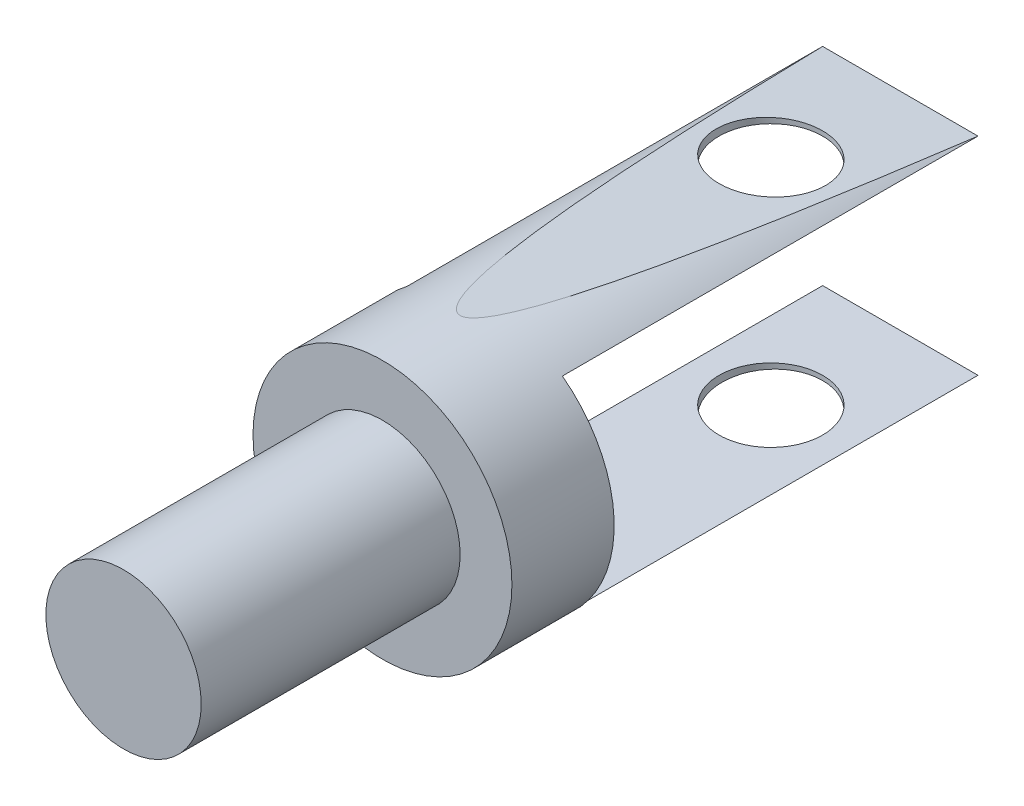
from build123d import *

# Parameters (mm, degrees)
SKETCH1_R           = 5
BOSS_EXTRUDE1_DEPTH = 20
SKETCH2_R           = 3
BOSS_EXTRUDE2_DEPTH = 10
CUT_EXTRUDE1_DEPTH  = 5
SKETCH4_W           = 16.051327138
SKETCH4_H           = 8
CUT_EXTRUDE2_DEPTH  = 5
SKETCH5_R           = 2
CUT_EXTRUDE3_DEPTH  = 5


with BuildPart() as part:
    # Sketch1 → Boss-Extrude1 (new body)
    with BuildSketch(Plane.XY):
        Circle(SKETCH1_R)
    extrude(amount=BOSS_EXTRUDE1_DEPTH)

    # Sketch2 → Boss-Extrude2 (add)
    with BuildSketch(Plane.XY.offset(20)):
        Circle(SKETCH2_R)
    extrude(amount=BOSS_EXTRUDE2_DEPTH)

    # Sketch3 → Cut-Extrude1 (cut, symmetric)
    with BuildSketch(Plane(origin=(0, 0, 0), x_dir=(0, 0, -1), z_dir=(1, 0, 0))):
        Polygon((0, 5), (-17, 5), (0, 4), align=None)
        Polygon((-17, -5), (0, -5), (0, -4), align=None)
    extrude(amount=CUT_EXTRUDE1_DEPTH, both=True, mode=Mode.SUBTRACT)

    # Sketch4 → Cut-Extrude2 (cut, symmetric)
    with BuildSketch(Plane(origin=(0, 0, 0), x_dir=(0, 0, -1), z_dir=(1, 0, 0))):
        with Locations((-8.025663569, 0)):
            Rectangle(SKETCH4_W, SKETCH4_H)
    extrude(amount=CUT_EXTRUDE2_DEPTH, both=True, mode=Mode.SUBTRACT)

    # Sketch5 → Cut-Extrude3 (cut, symmetric)
    with BuildSketch(Plane(origin=(0, 0, 0), x_dir=(1, 0, 0), z_dir=(0, 1, 0))):
        with Locations(Location((0, -5, 0), (0, 0, 90))):
            Circle(SKETCH5_R)
    extrude(amount=CUT_EXTRUDE3_DEPTH, both=True, mode=Mode.SUBTRACT)


solid = part.part
